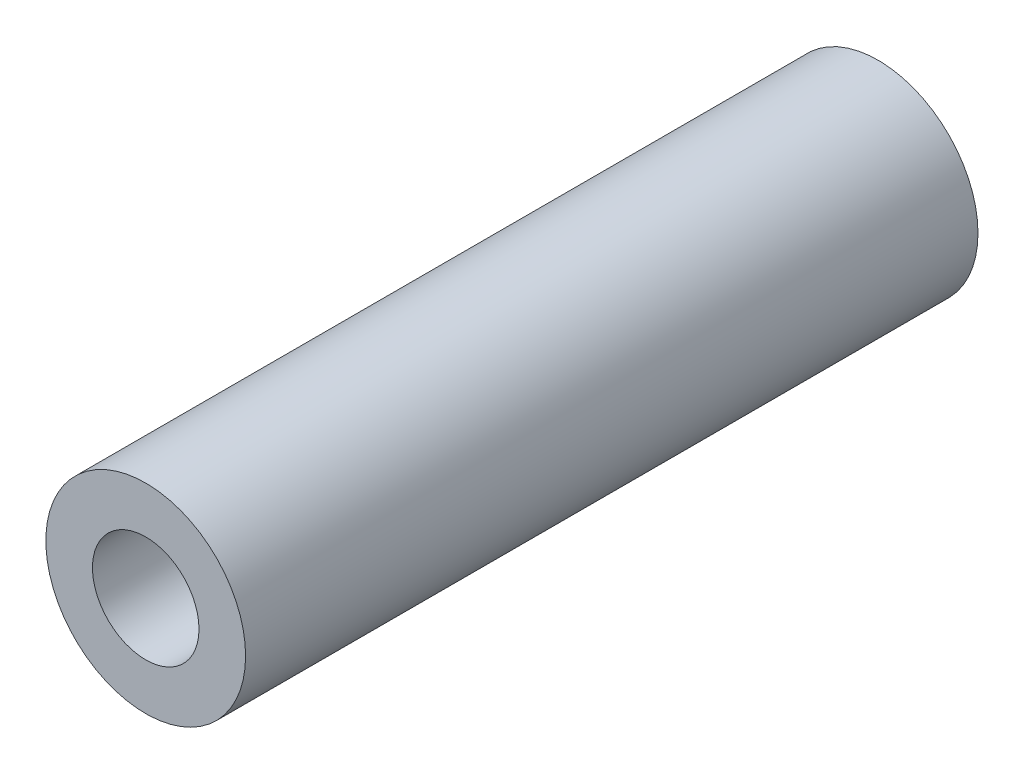
from build123d import *

# Parameters (mm, degrees)
SKETCH1_R           = 15
SKETCH1_R_2         = 8
BOSS_EXTRUDE1_DEPTH = 110


with BuildPart() as part:
    # Sketch1 → Boss-Extrude1 (new body)
    with BuildSketch(Plane.XY):
        Circle(SKETCH1_R)
        Circle(SKETCH1_R_2, mode=Mode.SUBTRACT)
    extrude(amount=BOSS_EXTRUDE1_DEPTH)


solid = part.part
